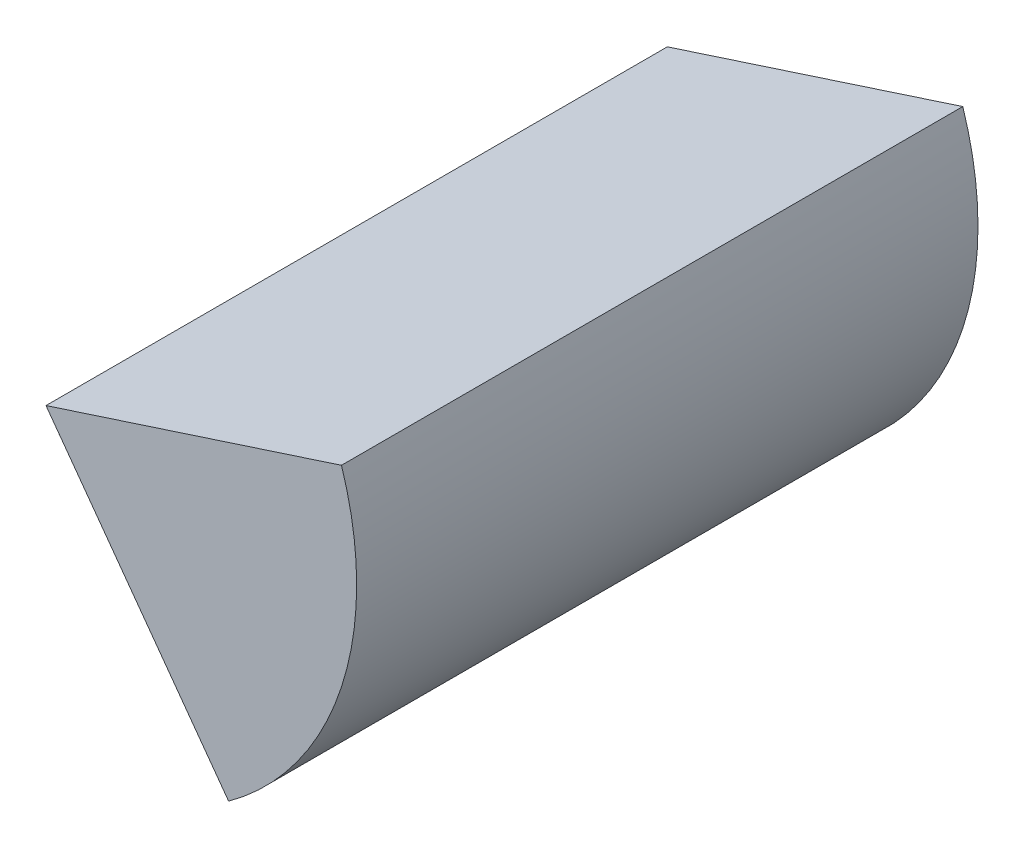
from build123d import *

# Parameters (mm, degrees)
SALIENTE_EXTRUIR1_DEPTH = 50
CROQUIS2_R              = 5
CORTAR_EXTRUIR1_DEPTH   = 10


with BuildPart() as part:
    # Croquis1 → Saliente-Extruir1 (new body)
    with BuildSketch(Plane.XY):
        with BuildLine():
            Line((0, 0), (23.776412907, 7.725424859))
            ThreePointArc((23.776412907, 7.725424859), (23.776412907, -7.725424859), (14.694631307, -20.225424859))
            Line((14.694631307, -20.225424859), (0, 0))
        make_face()
    extrude(amount=SALIENTE_EXTRUIR1_DEPTH)

    # Croquis2 → Cortar-Extruir1 (cut)
    with BuildSketch(Plane(origin=(0, 0, 0), x_dir=(-1, 0, 0), z_dir=(0, 0, -1))):
        with Locations((-15.166331027, -4.655462779)):
            Circle(CROQUIS2_R)
    extrude(amount=-CORTAR_EXTRUIR1_DEPTH, mode=Mode.SUBTRACT)


solid = part.part
